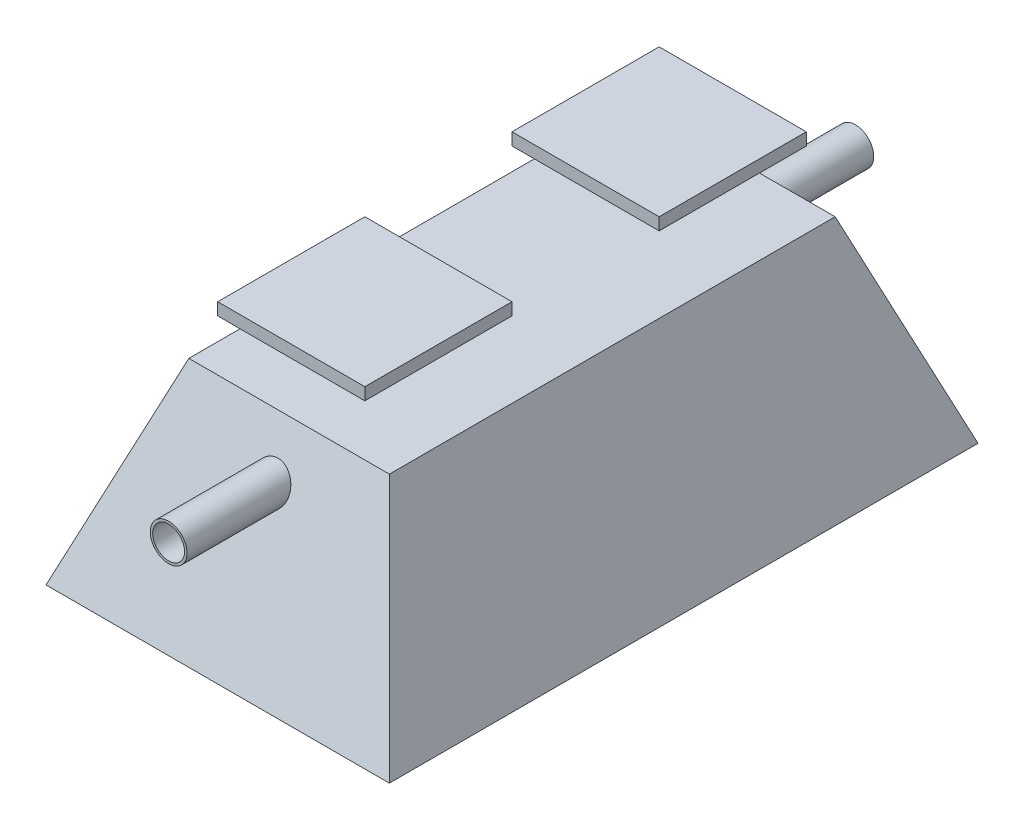
from build123d import *

# Parameters (mm, degrees)
SKETCH1_W                = 355.6
SKETCH1_H                = 609.6
BOSS_EXTRUDE1_DEPTH      = 203.2
BOSS_EXTRUDE1_TAPER      = 20
BOSS_EXTRUDE2_DEPTH      = 355.6
BOSS_EXTRUDE2_DEPTH_BACK = 355.6
SKETCH2_R                = 19.05
SKETCH2_R_2              = 12.7
SHELL1_T                 = -2.54
CUT_EXTRUDE1_DEPTH       = 759.354848219
CUT_EXTRUDE1_DEPTH_BACK  = 759.354848219
SKETCH3_R                = 16.51
SKETCH4_R                = 6.35
BOSS_EXTRUDE3_DEPTH      = 50.8
SKETCH5_W                = 152.4
SKETCH5_H                = 152.4
BOSS_EXTRUDE4_DEPTH      = 12.7
SKETCH6_W                = 350.193976916
SKETCH6_H                = 604.193976916
BOSS_EXTRUDE5_DEPTH      = 2.54


with BuildPart() as part:
    # Sketch1 → Boss-Extrude1 (new body)
    with BuildSketch(Plane(origin=(0, 0, 0), x_dir=(1, 0, 0), z_dir=(0, 1, 0))):
        Rectangle(SKETCH1_W, SKETCH1_H)
    extrude(amount=BOSS_EXTRUDE1_DEPTH, taper=BOSS_EXTRUDE1_TAPER)

    # Sketch2 → Boss-Extrude2 (add, two sides: drawn at the far end of the back side and taken through both)
    with BuildSketch(Plane.XY.offset(-BOSS_EXTRUDE2_DEPTH_BACK)):
        with Locations((0, 152.4)):
            Circle(SKETCH2_R)
        with Locations((0, 152.4)):
            Circle(SKETCH2_R_2, mode=Mode.SUBTRACT)
    extrude(amount=BOSS_EXTRUDE2_DEPTH + BOSS_EXTRUDE2_DEPTH_BACK)

    # Shell1
    shell1_openings = [part.faces().sort_by_distance(p)[0] for p in [
        (0, 0, 0),
    ]]
    offset(amount=SHELL1_T, openings=shell1_openings, kind=Kind.INTERSECTION)

    # Sketch3 → Cut-Extrude1 (cut, two sides: drawn at the far end of the back side and taken through both)
    with BuildSketch(Plane(origin=(0, 0, 353.06), x_dir=(-1, 0, 0), z_dir=(0, 0, -1)).offset(-CUT_EXTRUDE1_DEPTH_BACK)):
        with Locations(Location((0, 152.4, 0), (0, 0, 270))):
            Circle(SKETCH3_R)
    extrude(amount=CUT_EXTRUDE1_DEPTH + CUT_EXTRUDE1_DEPTH_BACK, mode=Mode.SUBTRACT)

    # Sketch4 → Boss-Extrude3 (add)
    with BuildSketch(Plane(origin=(0, 203.2, 0), x_dir=(1, 0, 0), z_dir=(0, 1, 0))):
        with Locations(Location((0, 152.4, 0), (0, 0, 270))):
            Circle(SKETCH4_R)
        with Locations(Location((0, -152.4, 0), (0, 0, 270))):
            Circle(SKETCH4_R)
    extrude(amount=BOSS_EXTRUDE3_DEPTH)

    # Sketch5 → Boss-Extrude4 (add)
    with BuildSketch(Plane(origin=(0, 254, 0), x_dir=(1, 0, 0), z_dir=(0, 1, 0))):
        with Locations((0, 152.4)):
            Rectangle(SKETCH5_W, SKETCH5_H)
        with Locations((0, -152.4)):
            Rectangle(SKETCH5_W, SKETCH5_H)
    extrude(amount=BOSS_EXTRUDE4_DEPTH)


with BuildPart() as body_2:
    # Sketch6 → Boss-Extrude5 (new body)
    with BuildSketch(Plane.XZ):
        Rectangle(SKETCH6_W, SKETCH6_H)
    extrude(amount=-BOSS_EXTRUDE5_DEPTH)


solid = Compound([part.part, body_2.part])
